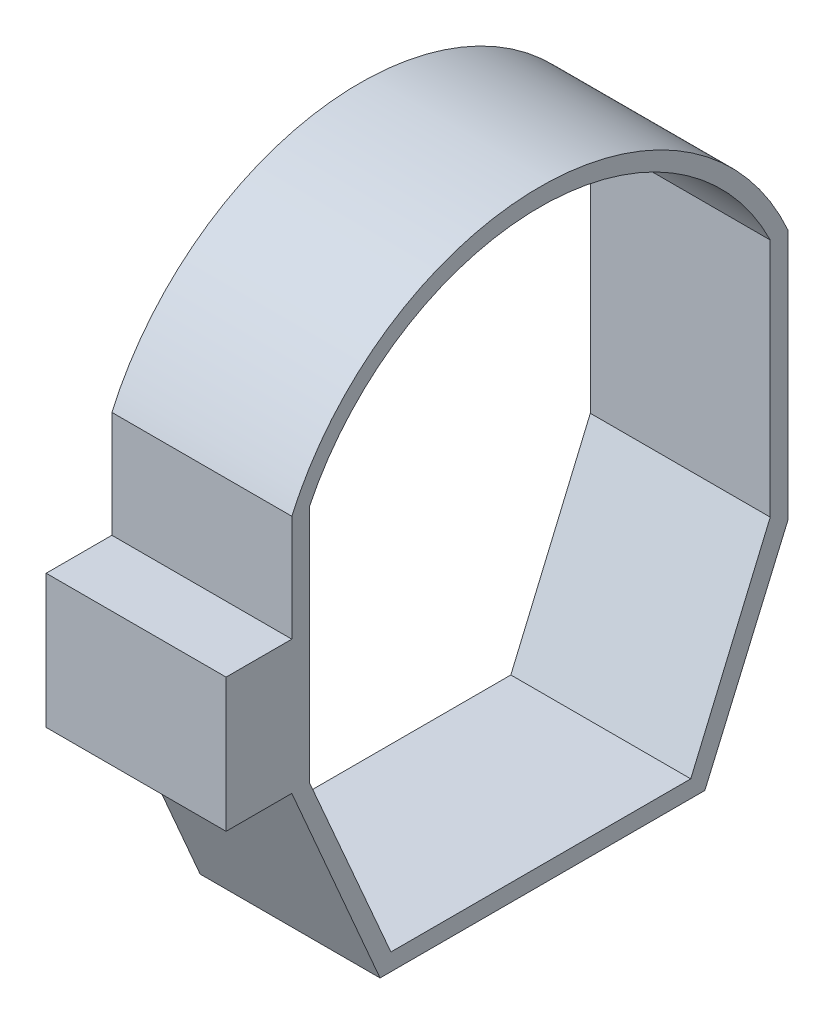
from build123d import *

# Parameters (mm, degrees)
BOSS_EXTRUDE1_DEPTH      = 3.81
BOSS_EXTRUDE1_DEPTH_BACK = 3.81
SKETCH3_W                = 2.783274099
SKETCH3_H                = 5.656099036
BOSS_EXTRUDE2_DEPTH      = 7.62


with BuildPart() as part:
    # Sketch2 → Boss-Extrude1 (new, two sides: drawn at the far end of the back side and taken through both)
    with BuildSketch(Plane(origin=(-2.32915921, 0, 0), x_dir=(0, 0, -1), z_dir=(1, 0, 0)).offset(-BOSS_EXTRUDE1_DEPTH_BACK)):
        with BuildLine():
            Line((-11.339007657, 18.600950631), (-11.339007657, 8.436760495))
            Line((-11.339007657, 8.436760495), (-7.601027883, -0.203787431))
            Line((-7.601027883, -0.203787431), (6.154737684, -0.203787431))
            Line((6.154737684, -0.203787431), (9.668438671, 7.945008476))
            Line((9.668438671, 7.945008476), (9.668438671, 18.600950631))
            ThreePointArc((9.668438671, 18.600950631), (-0.835284493, 25.430388096), (-11.339007657, 18.600950631))
        make_face()
        with BuildLine():
            Line((8.923024063, 18.600950631), (8.923024063, 8.436760495))
            Line((8.923024063, 8.436760495), (5.557346164, 0.521588901))
            Line((5.557346164, 0.521588901), (-7.142653836, 0.521588901))
            Line((-7.142653836, 0.521588901), (-10.584175937, 8.436760495))
            Line((-10.584175937, 8.436760495), (-10.584175937, 18.600950631))
            ThreePointArc((-10.584175937, 18.600950631), (-0.830575937, 24.692849221), (8.923024063, 18.600950631))
        make_face(mode=Mode.SUBTRACT)
    extrude(amount=BOSS_EXTRUDE1_DEPTH + BOSS_EXTRUDE1_DEPTH_BACK)

    # Sketch3 → Boss-Extrude2 (add)
    with BuildSketch(Plane(origin=(1.48084079, 0, 0), x_dir=(0, 0, -1), z_dir=(1, 0, 0))):
        with Locations((-12.730644707, 11.264810013)):
            Rectangle(SKETCH3_W, SKETCH3_H)
    extrude(amount=-BOSS_EXTRUDE2_DEPTH)


solid = part.part
